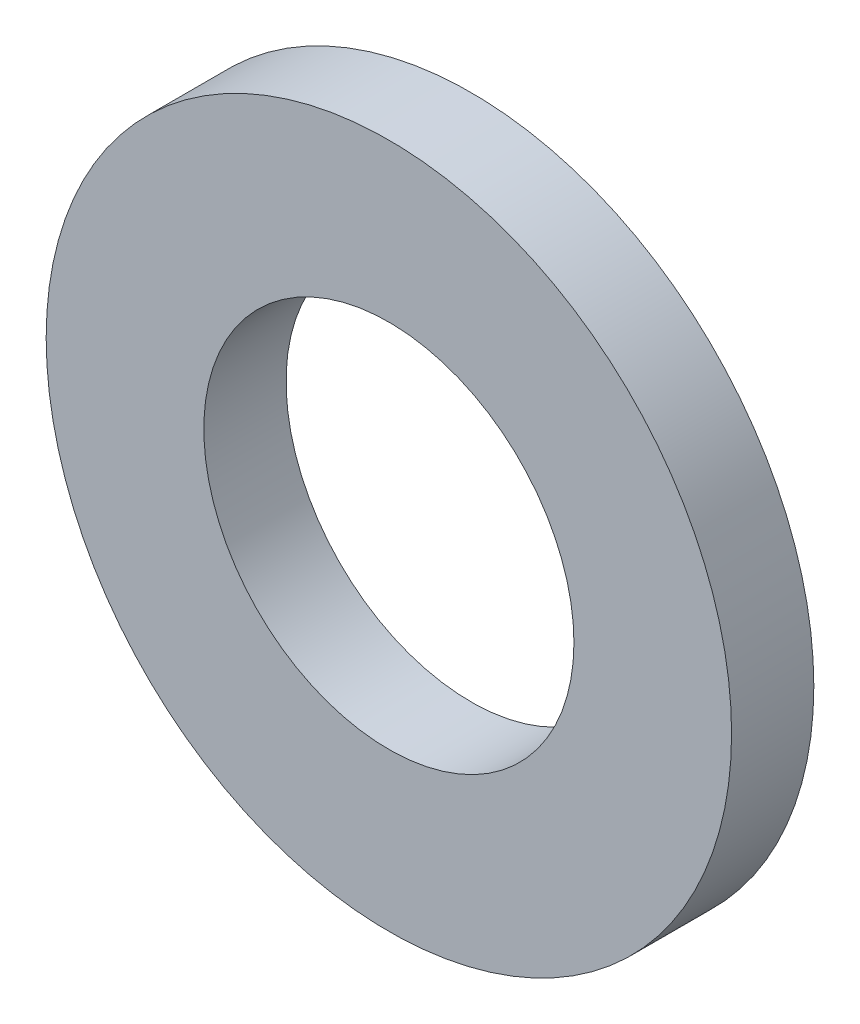
from build123d import *

# Parameters (mm, degrees)
SKETCH1_R           = 2.5
SKETCH1_R_2         = 1.35
BOSS_EXTRUDE1_DEPTH = 0.6


with BuildPart() as part:
    # Sketch1 → Boss-Extrude1 (new body)
    with BuildSketch(Plane.XY):
        Circle(SKETCH1_R)
        Circle(SKETCH1_R_2, mode=Mode.SUBTRACT)
    extrude(amount=BOSS_EXTRUDE1_DEPTH)


solid = part.part
